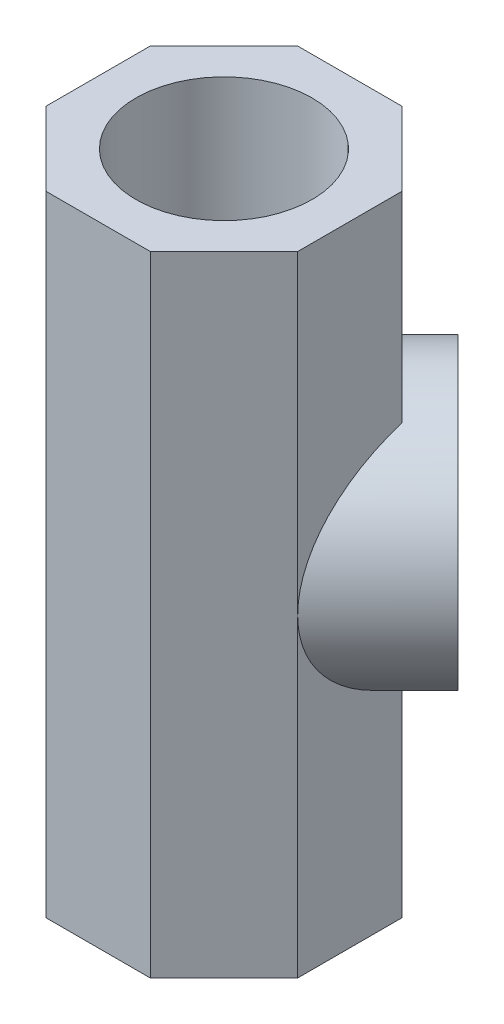
from build123d import *

# Parameters (mm, degrees)
SKETCH1_R           = 11.1125
BOSS_EXTRUDE1_DEPTH = 79.375
BOSS_EXTRUDE2_REACH = 92.43
SKETCH2_R           = 15.875


with BuildPart() as part:
    # Sketch1 → Boss-Extrude1 (new body)
    with BuildSketch(Plane(origin=(0, 0, 0), x_dir=(1, 0, 0), z_dir=(0, 1, 0))):
        Polygon((6.575640303, -15.875), (15.875, -6.575640303), (15.875, 6.575640303), (6.575640303, 15.875), (-6.575640303, 15.875), (-15.875, 6.575640303), (-15.875, -6.575640303), (-6.575640303, -15.875), align=None)
        with Locations(Location((0, 0, 0), (0, 0, 90))):
            Circle(SKETCH1_R, mode=Mode.SUBTRACT)
    extrude(amount=BOSS_EXTRUDE1_DEPTH)

    # Sketch2 → Boss-Extrude2 (add, up to next)
    with BuildSketch(Plane(origin=(14.760854057, 0, -14.760854057), x_dir=(-0.7071067811865476, 0, -0.7071067811865475), z_dir=(0.7071067811865475, 0, -0.7071067811865476)), mode=Mode.PRIVATE) as boss_extrude2_sk1:
        with Locations((0, 39.634677984)):
            Circle(SKETCH2_R)
    boss_extrude2_tool1 = extrude(boss_extrude2_sk1.sketch, amount=-BOSS_EXTRUDE2_REACH, mode=Mode.PRIVATE) - part.part
    add(boss_extrude2_tool1.solids().sort_by_distance((14.760854, 39.634678, -14.760854))[0])


solid = part.part
